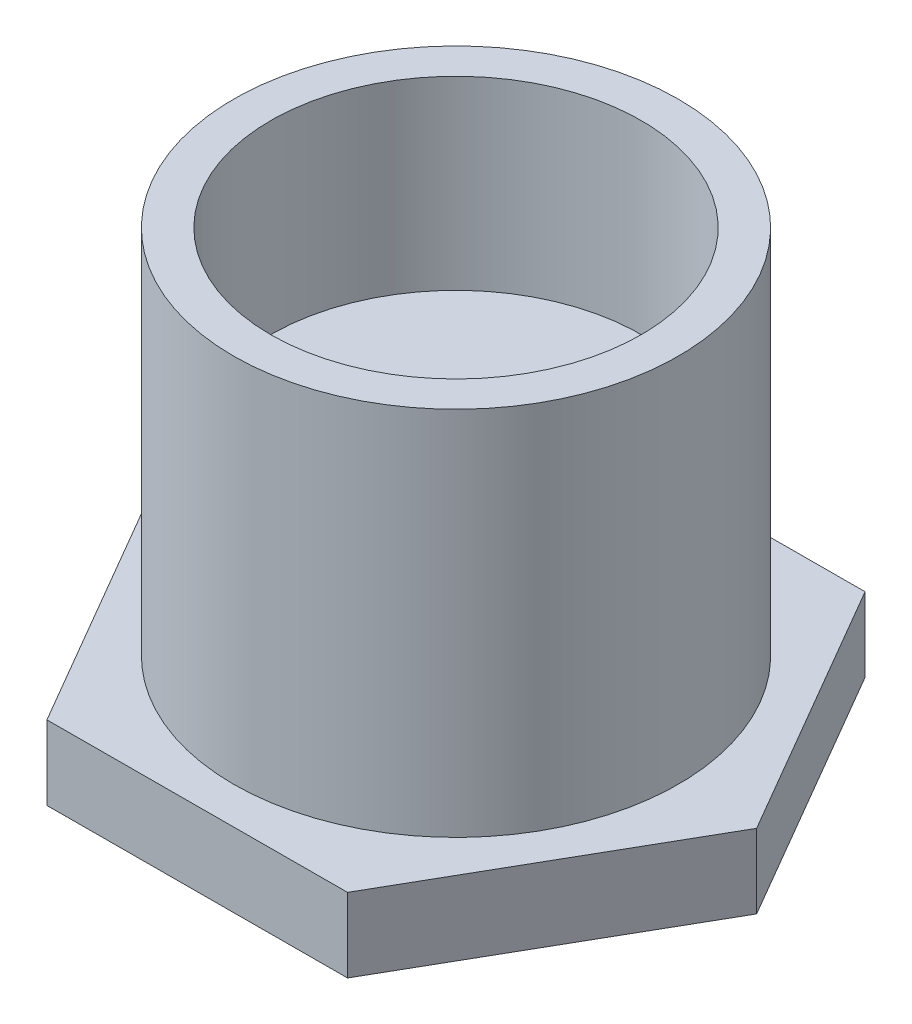
from build123d import *

# Parameters (mm, degrees)
EXTRUDE_1_DEPTH     = 2
SKETCH_2_R          = 6
EXTRUDE_2_DEPTH     = 10
SKETCH_3_R          = 5
CUT_EXTRUDE_1_DEPTH = 5


with BuildPart() as part:
    # ｽｹｯﾁ1 → ﾎﾞｽ - 押し出し1 (new body)
    with BuildSketch(Plane(origin=(0, 0, 0), x_dir=(1, 0, 0), z_dir=(0, 1, 0))):
        Polygon((4.062937169, -6.987551424), (8.082865627, 0.02483109), (4.019928459, 7.012382514), (-4.062937169, 6.987551424), (-8.082865627, -0.02483109), (-4.019928459, -7.012382514), align=None)
    extrude(amount=EXTRUDE_1_DEPTH)

    # ｽｹｯﾁ2 → ﾎﾞｽ - 押し出し2 (add)
    with BuildSketch(Plane(origin=(0, 2, 0), x_dir=(1, 0, 0), z_dir=(0, 1, 0))):
        with Locations(Location((0, 0, 0), (0, 0, 270))):
            Circle(SKETCH_2_R)
    extrude(amount=EXTRUDE_2_DEPTH)

    # ｽｹｯﾁ3 → ｶｯﾄ - 押し出し1 (cut)
    with BuildSketch(Plane(origin=(0, 12, 0), x_dir=(1, 0, 0), z_dir=(0, 1, 0))):
        with Locations(Location((0, 0, 0), (0, 0, 270))):
            Circle(SKETCH_3_R)
    extrude(amount=-CUT_EXTRUDE_1_DEPTH, mode=Mode.SUBTRACT)


solid = part.part
